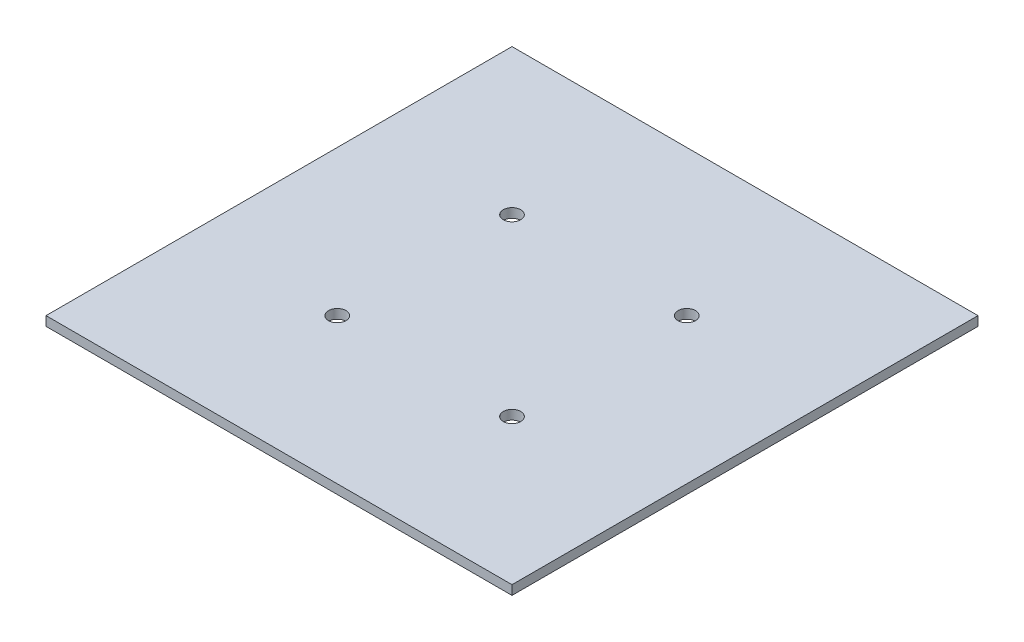
from build123d import *

# Parameters (mm, degrees)
ESQUISSE1_W      = 80
ESQUISSE1_H      = 80
ESQUISSE1_R      = 1.5
EXTRUSION1_DEPTH = 1.6


with BuildPart() as part:
    # Esquisse1 → Extrusion1 (new body)
    with BuildSketch(Plane(origin=(0, 0, 0), x_dir=(1, 0, 0), z_dir=(0, 1, 0))):
        Rectangle(ESQUISSE1_W, ESQUISSE1_H)
        with Locations(Location((15, 15, 0), (0, 0, 270))):
            Circle(ESQUISSE1_R, mode=Mode.SUBTRACT)
        with Locations(Location((-15, 15, 0), (0, 0, 90))):
            Circle(ESQUISSE1_R, mode=Mode.SUBTRACT)
        with Locations(Location((15, -15, 0), (0, 0, 90))):
            Circle(ESQUISSE1_R, mode=Mode.SUBTRACT)
        with Locations(Location((-15, -15, 0), (0, 0, 270))):
            Circle(ESQUISSE1_R, mode=Mode.SUBTRACT)
    extrude(amount=EXTRUSION1_DEPTH)


solid = part.part
